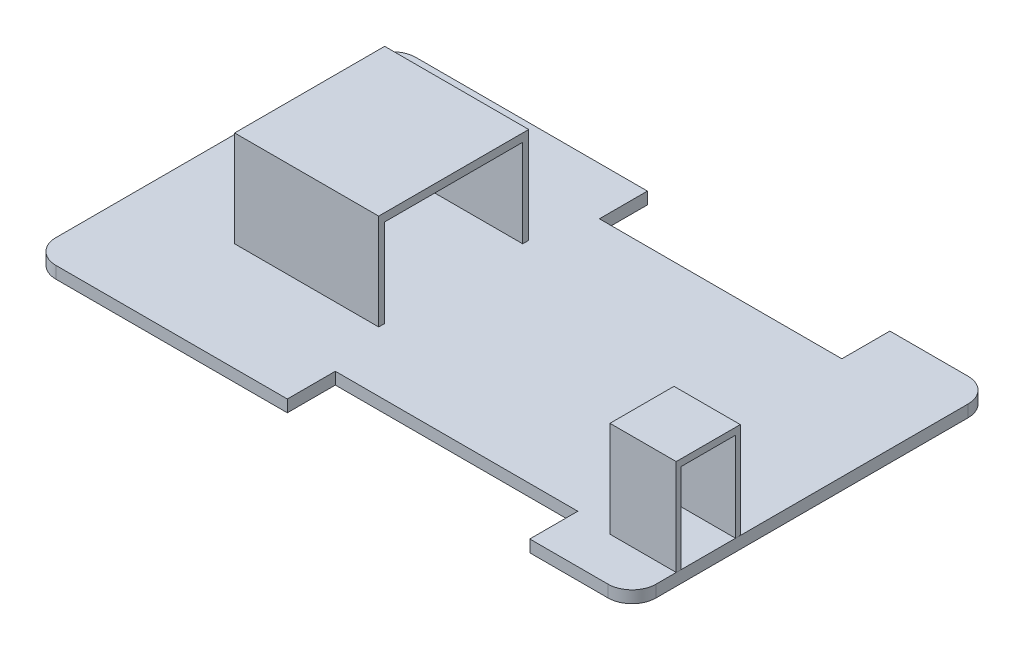
from build123d import *

# Parameters (mm, degrees)
BOSS_EXTRUDE1_DEPTH = 5
SKETCH2_W           = 27.600843984
SKETCH2_H           = 2
SKETCH2_W_2         = 60
SKETCH2_H_2         = 2.5
BOSS_EXTRUDE2_DEPTH = 40
SKETCH4_W           = 27.600843984
SKETCH4_H           = 2.834104075
BOSS_EXTRUDE4_DEPTH = 22.691339628
SKETCH5_W           = 60
SKETCH5_H           = 3.359629359
BOSS_EXTRUDE5_DEPTH = 57.5
FILLET1_R           = 10


with BuildPart() as part:
    # Sketch1 → Boss-Extrude1 (new body)
    with BuildSketch(Plane(origin=(0, 0, 0), x_dir=(1, 0, 0), z_dir=(0, 1, 0))):
        Polygon((106.407471576, 20), (207.407471576, 20), (207.407471576, 0), (250, 0), (250, 150), (207.407471576, 150), (207.407471576, 130), (106.407471576, 130), (106.407471576, 150), (0, 150), (0, 0), (106.407471576, 0), align=None)
    extrude(amount=BOSS_EXTRUDE1_DEPTH)

    # Sketch2 → Boss-Extrude2 (add)
    with BuildSketch(Plane(origin=(0, 5, 0), x_dir=(1, 0, 0), z_dir=(0, 1, 0))):
        with Locations((236.181530472, 44.106973221)):
            Rectangle(SKETCH2_W, SKETCH2_H)
        with Locations((236.181530472, 19.415633593)):
            Rectangle(SKETCH2_W, SKETCH2_H)
        with Locations((69.460984605, 106.25)):
            Rectangle(SKETCH2_W_2, SKETCH2_H_2)
        with Locations((69.460984605, 46.25)):
            Rectangle(SKETCH2_W_2, SKETCH2_H_2)
    extrude(amount=BOSS_EXTRUDE2_DEPTH)

    # Sketch4 → Boss-Extrude4 (add)
    with BuildSketch(Plane.XY.offset(-43.106973221)):
        with Locations((236.181530472, 43.582947963)):
            Rectangle(SKETCH4_W, SKETCH4_H)
    extrude(amount=BOSS_EXTRUDE4_DEPTH)

    # Sketch5 → Boss-Extrude5 (add)
    with BuildSketch(Plane(origin=(0, 0, -47.5), x_dir=(-1, 0, 0), z_dir=(0, 0, -1))):
        with Locations((-69.460984605, 43.320185321)):
            Rectangle(SKETCH5_W, SKETCH5_H)
    extrude(amount=BOSS_EXTRUDE5_DEPTH)

    # Fillet1
    fillet1_edges = [part.edges().sort_by_distance(p)[0] for p in [
        (0, 2.5, -150),
        (250, 2.5, -150),
        (250, 2.5, 0),
        (0, 2.5, 0),
    ]]
    fillet(fillet1_edges, radius=FILLET1_R)


solid = part.part
